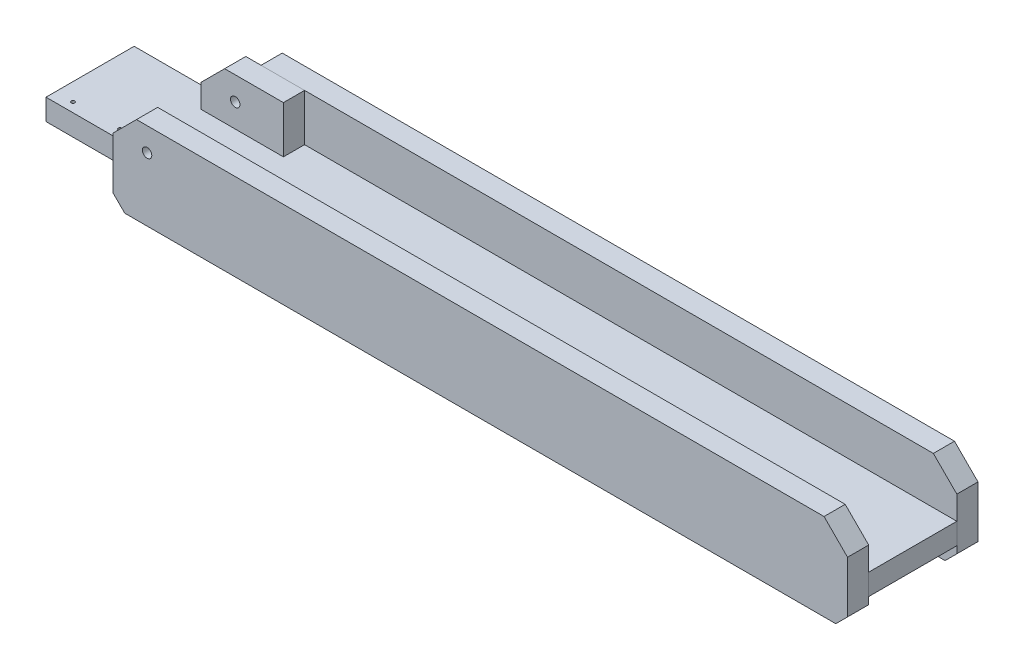
from build123d import *

# Parameters (mm, degrees)
SKETCH1_W           = 700
SKETCH1_H           = 75
BOSS_EXTRUDE1_DEPTH = 18
SKETCH2_W           = 625
SKETCH2_H           = 74
SKETCH2_R           = 4
BOSS_EXTRUDE2_DEPTH = 18
CHAMFER1_SIZE       = 20
CHAMFER2_SIZE       = 10
SKETCH3_R           = 4
BOSS_EXTRUDE3_DEPTH = 18
SKETCH4_W           = 18
SKETCH4_H           = 74
CUT_EXTRUDE1_DEPTH  = 33
SKETCH5_R           = 1.5
CUT_EXTRUDE2_DEPTH  = 10
SKETCH6_R           = 1.5
CUT_EXTRUDE3_DEPTH  = 10


with BuildPart() as part:
    # Sketch1 → Boss-Extrude1 (new body)
    with BuildSketch(Plane(origin=(0, 0, 0), x_dir=(1, 0, 0), z_dir=(0, 1, 0))):
        with Locations((350, 0)):
            Rectangle(SKETCH1_W, SKETCH1_H)
    extrude(amount=BOSS_EXTRUDE1_DEPTH)

    # Sketch6 → Cut-Extrude3 (cut)
    with BuildSketch(Plane(origin=(0, 18, 0), x_dir=(1, 0, 0), z_dir=(0, 1, 0))):
        with Locations(Location((55, -29.5, 0), (0, 0, 270))):
            Circle(SKETCH6_R)
        with Locations(Location((15, -29.5, 0), (0, 0, 270))):
            Circle(SKETCH6_R)
    extrude(amount=-CUT_EXTRUDE3_DEPTH, mode=Mode.SUBTRACT)


with BuildPart() as body_2:
    # Sketch2 → Boss-Extrude2 (new body)
    with BuildSketch(Plane.XY.offset(37.5)):
        with Locations((387.5, 21)):
            Rectangle(SKETCH2_W, SKETCH2_H)
        with Locations((104, 38)):
            Circle(SKETCH2_R, mode=Mode.SUBTRACT)
    extrude(amount=BOSS_EXTRUDE2_DEPTH)

    # Chamfer1
    chamfer1_edges = [body_2.edges().sort_by_distance(p)[0] for p in [
        (75, 58, 46.5),
        (700, 58, 46.5),
    ]]
    chamfer(chamfer1_edges, length=CHAMFER1_SIZE)

    # Chamfer2
    chamfer2_edges = [body_2.edges().sort_by_distance(p)[0] for p in [
        (700, -16, 46.5),
        (75, -16, 46.5),
    ]]
    chamfer(chamfer2_edges, length=CHAMFER2_SIZE)


with BuildPart() as body_3:
    # Mirror1: mirrored copy
    add(body_2.part.mirror(Plane.XY))

    # Sketch4 → Cut-Extrude1 (cut)
    with BuildSketch(Plane.ZY.offset(-75)):
        with Locations((-46.5, 21)):
            Rectangle(SKETCH4_W, SKETCH4_H)
    extrude(amount=-CUT_EXTRUDE1_DEPTH, mode=Mode.SUBTRACT)

    # Sketch5 → Cut-Extrude2 (cut)
    with BuildSketch(Plane.ZY.offset(-108)):
        with Locations((-45.5, -1)):
            Circle(SKETCH5_R)
        with Locations((-45.5, 39)):
            Circle(SKETCH5_R)
    extrude(amount=-CUT_EXTRUDE2_DEPTH, mode=Mode.SUBTRACT)


with BuildPart() as body_4:
    # Sketch3 → Boss-Extrude3 (new body)
    with BuildSketch(Plane.XY.offset(-37.5)):
        Polygon((75, 38), (75, 18), (145, 18), (145, 58), (95, 58), align=None)
        with Locations((104, 38)):
            Circle(SKETCH3_R, mode=Mode.SUBTRACT)
    extrude(amount=BOSS_EXTRUDE3_DEPTH)


solid = Compound([part.part, body_2.part, body_3.part, body_4.part])
